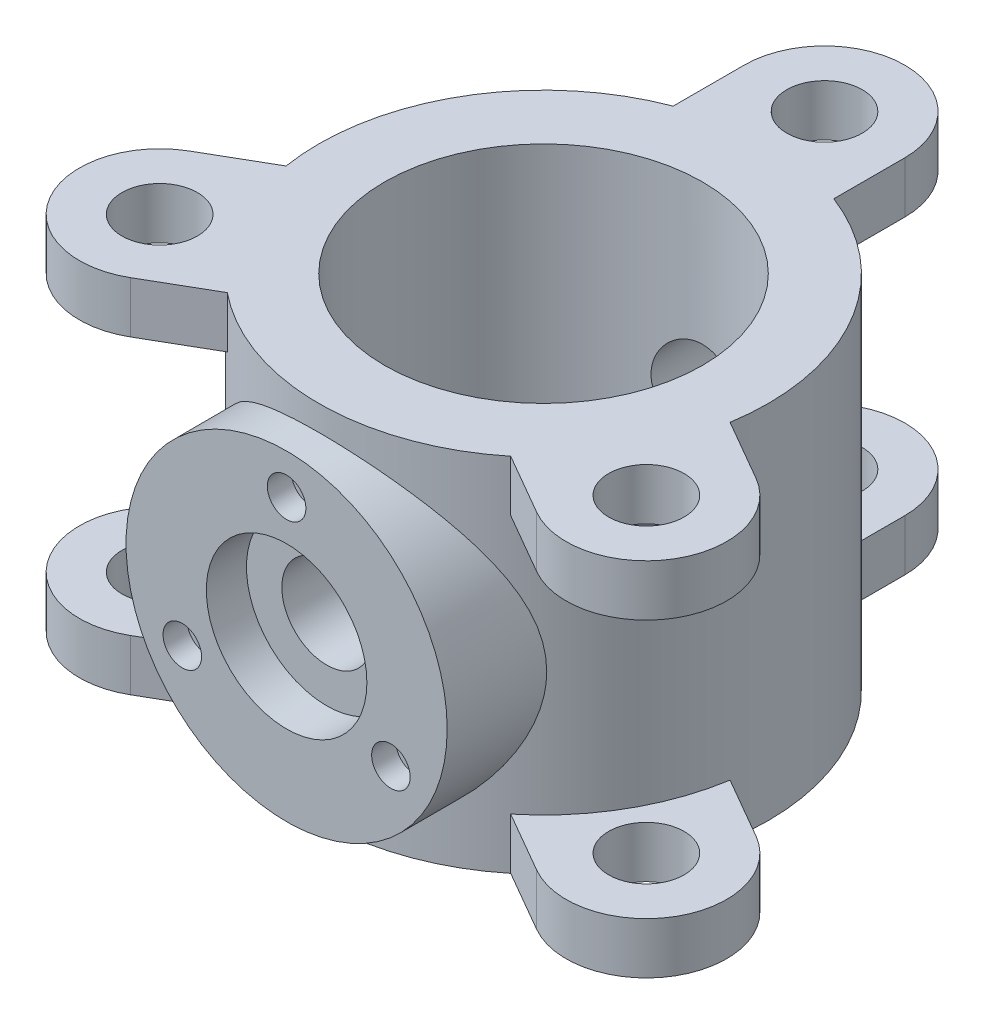
from build123d import *

# Parameters (mm, degrees)
SKETCH1_R                = 140
BOSS_EXTRUDE1_DEPTH      = 225
SKETCH2_R                = 99
CUT_EXTRUDE1_DEPTH       = 300.708191413
BOSS_EXTRUDE2_START      = -32
BOSS_EXTRUDE2_DEPTH      = 32
CIRPATTERN1_COUNT        = 3
CIRPATTERN2_START        = -32
CIRPATTERN2_COPY_1_DEPTH = 32
CIRPATTERN2_COPY_2_DEPTH = 32
CIRPATTERN2_COPY_3_DEPTH = 32
CIRPATTERN2_COPY_4_DEPTH = 32
BOSS_EXTRUDE3_REACH      = 491.361
SKETCH5_R                = 100
SKETCH6_R                = 50
CUT_EXTRUDE2_DEPTH       = 25
SKETCH9_R                = 28
CUT_EXTRUDE3_DEPTH       = 490.361006427
SKETCH11_R               = 12
CUT_EXTRUDE4_DEPTH       = 15
CIRPATTERN4_COUNT        = 3


with BuildPart() as part:
    # Sketch1 → Boss-Extrude1 (new body)
    with BuildSketch(Plane(origin=(0, 0, 0), x_dir=(1, 0, 0), z_dir=(0, 1, 0))):
        Circle(SKETCH1_R)
    extrude(amount=BOSS_EXTRUDE1_DEPTH)

    # Sketch2 → Cut-Extrude1 (cut, through all)
    with BuildSketch(Plane(origin=(0, 225, 0), x_dir=(1, 0, 0), z_dir=(0, 1, 0))):
        Circle(SKETCH2_R)
    extrude(amount=-CUT_EXTRUDE1_DEPTH, mode=Mode.SUBTRACT)

    # Sketch3 → Boss-Extrude2 (add)
    with BuildSketch(Plane(origin=(0, 225, 0), x_dir=(1, 0, 0), z_dir=(0, 1, 0)).offset(BOSS_EXTRUDE2_START)):
        with BuildLine():
            ThreePointArc((50, 175), (0, 225), (-50, 175))
            Line((-50, 175), (-50, 130.766968306))
            ThreePointArc((-50, 130.766968306), (0, 140), (50, 130.766968306))
            Line((50, 130.766968306), (50, 175))
        make_face()
        with BuildLine():
            ThreePointArc((-23.5, 175), (0, 198.5), (23.5, 175))
            ThreePointArc((23.5, 175), (0, 151.5), (-23.5, 175))
        make_face(mode=Mode.SUBTRACT)
    boss_extrude2 = extrude(amount=BOSS_EXTRUDE2_DEPTH)

    # CirPattern1: Boss-Extrude2 ×3 about axis
    cirpattern1_axis = Axis((0, 225, 0), (0, -1, 0))
    for i in range(1, CIRPATTERN1_COUNT):
        add(boss_extrude2.rotate(cirpattern1_axis, i * 360 / CIRPATTERN1_COUNT))

    # Mirror3: Boss-Extrude2 across plane
    add(boss_extrude2.mirror(Plane(origin=(0, 112.5, 0), x_dir=(0, 0, 1), z_dir=(0, -1, 0))))

    # CirPattern2 copy 1 sketch → CirPattern2 copy 1 (add)
    with BuildSketch(Plane(origin=(0, 0, 0), x_dir=(-0.4999999999999998, 0, 0.8660254037844387), z_dir=(0, -1, 0)).offset(CIRPATTERN2_START)):
        with BuildLine():
            ThreePointArc((50, -175), (0, -225), (-50, -175))
            Line((-50, -175), (-50, -130.766968306))
            ThreePointArc((-50, -130.766968306), (0, -140), (50, -130.766968306))
            Line((50, -130.766968306), (50, -175))
        make_face()
        with BuildLine():
            ThreePointArc((-23.5, -175), (0, -198.5), (23.5, -175))
            ThreePointArc((23.5, -175), (0, -151.5), (-23.5, -175))
        make_face(mode=Mode.SUBTRACT)
    extrude(amount=CIRPATTERN2_COPY_1_DEPTH)

    # CirPattern2 copy 2 sketch → CirPattern2 copy 2 (add)
    with BuildSketch(Plane(origin=(0, 0, 0), x_dir=(-0.5000000000000004, 0, -0.8660254037844384), z_dir=(0, -1, 0)).offset(CIRPATTERN2_START)):
        with BuildLine():
            ThreePointArc((50, -175), (0, -225), (-50, -175))
            Line((-50, -175), (-50, -130.766968306))
            ThreePointArc((-50, -130.766968306), (0, -140), (50, -130.766968306))
            Line((50, -130.766968306), (50, -175))
        make_face()
        with BuildLine():
            ThreePointArc((-23.5, -175), (0, -198.5), (23.5, -175))
            ThreePointArc((23.5, -175), (0, -151.5), (-23.5, -175))
        make_face(mode=Mode.SUBTRACT)
    extrude(amount=CIRPATTERN2_COPY_2_DEPTH)

    # CirPattern2 copy 3 sketch → CirPattern2 copy 3 (add)
    with BuildSketch(Plane(origin=(0, 225, 0), x_dir=(-0.4999999999999998, 0, 0.8660254037844387), z_dir=(0, 1, 0)).offset(CIRPATTERN2_START)):
        with BuildLine():
            ThreePointArc((50, 175), (0, 225), (-50, 175))
            Line((-50, 175), (-50, 130.766968306))
            ThreePointArc((-50, 130.766968306), (0, 140), (50, 130.766968306))
            Line((50, 130.766968306), (50, 175))
        make_face()
        with BuildLine():
            ThreePointArc((-23.5, 175), (0, 198.5), (23.5, 175))
            ThreePointArc((23.5, 175), (0, 151.5), (-23.5, 175))
        make_face(mode=Mode.SUBTRACT)
    extrude(amount=CIRPATTERN2_COPY_3_DEPTH)

    # CirPattern2 copy 4 sketch → CirPattern2 copy 4 (add)
    with BuildSketch(Plane(origin=(0, 225, 0), x_dir=(-0.5000000000000004, 0, -0.8660254037844384), z_dir=(0, 1, 0)).offset(CIRPATTERN2_START)):
        with BuildLine():
            ThreePointArc((50, 175), (0, 225), (-50, 175))
            Line((-50, 175), (-50, 130.766968306))
            ThreePointArc((-50, 130.766968306), (0, 140), (50, 130.766968306))
            Line((50, 130.766968306), (50, 175))
        make_face()
        with BuildLine():
            ThreePointArc((-23.5, 175), (0, 198.5), (23.5, 175))
            ThreePointArc((23.5, 175), (0, 151.5), (-23.5, 175))
        make_face(mode=Mode.SUBTRACT)
    extrude(amount=CIRPATTERN2_COPY_4_DEPTH)

    # Sketch5 → Boss-Extrude3 (add, up to next)
    with BuildSketch(Plane.XY.offset(160), mode=Mode.PRIVATE) as boss_extrude3_sk1:
        with Locations((0, 109.390064354)):
            Circle(SKETCH5_R)
    boss_extrude3_tool1 = extrude(boss_extrude3_sk1.sketch, amount=-BOSS_EXTRUDE3_REACH, mode=Mode.PRIVATE) - part.part
    add(boss_extrude3_tool1.solids().sort_by_distance((0, 109.390064, 160))[0])

    # Sketch6 → Cut-Extrude2 (cut)
    with BuildSketch(Plane.XY.offset(160)):
        with Locations((0, 109.390064354)):
            Circle(SKETCH6_R)
    extrude(amount=-CUT_EXTRUDE2_DEPTH, mode=Mode.SUBTRACT)

    # Sketch9 → Cut-Extrude3 (cut, through all)
    with BuildSketch(Plane.XY.offset(160)):
        with Locations((0, 109.390064354)):
            Circle(SKETCH9_R)
    extrude(amount=-CUT_EXTRUDE3_DEPTH, mode=Mode.SUBTRACT)

    # Sketch11 → Cut-Extrude4 (cut)
    with BuildSketch(Plane.XY.offset(160)):
        with Locations((0, 184.390064354)):
            Circle(SKETCH11_R)
    cut_extrude4 = extrude(amount=-CUT_EXTRUDE4_DEPTH, mode=Mode.SUBTRACT)

    # CirPattern4: Cut-Extrude4 ×3 about axis
    cirpattern4_axis = Axis((0, 109.390064354, 93.30090731), (0, 0, 1))
    for i in range(1, CIRPATTERN4_COUNT):
        add(cut_extrude4.rotate(cirpattern4_axis, i * 360 / CIRPATTERN4_COUNT), mode=Mode.SUBTRACT)


solid = part.part
